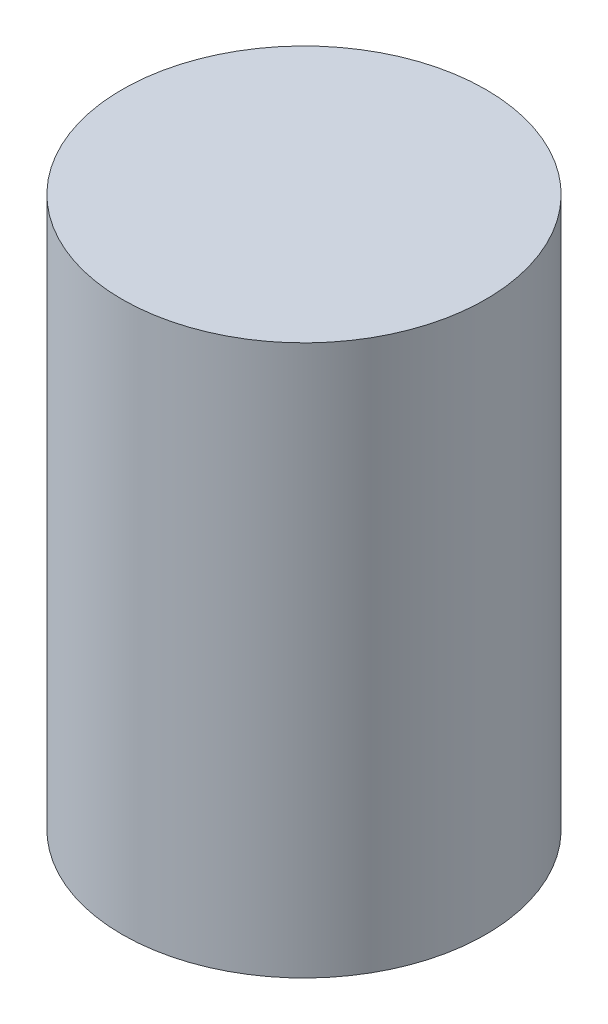
from build123d import *

# Parameters (mm, degrees)
SKETCH1_R           = 30.226
BOSS_EXTRUDE1_DEPTH = 91.44


with BuildPart() as part:
    # Sketch1 → Boss-Extrude1 (new body)
    with BuildSketch(Plane(origin=(0, 0, 0), x_dir=(1, 0, 0), z_dir=(0, 1, 0))):
        with Locations(Location((0, 0, 0), (0, 0, 270))):
            Circle(SKETCH1_R)
    extrude(amount=BOSS_EXTRUDE1_DEPTH)


solid = part.part
